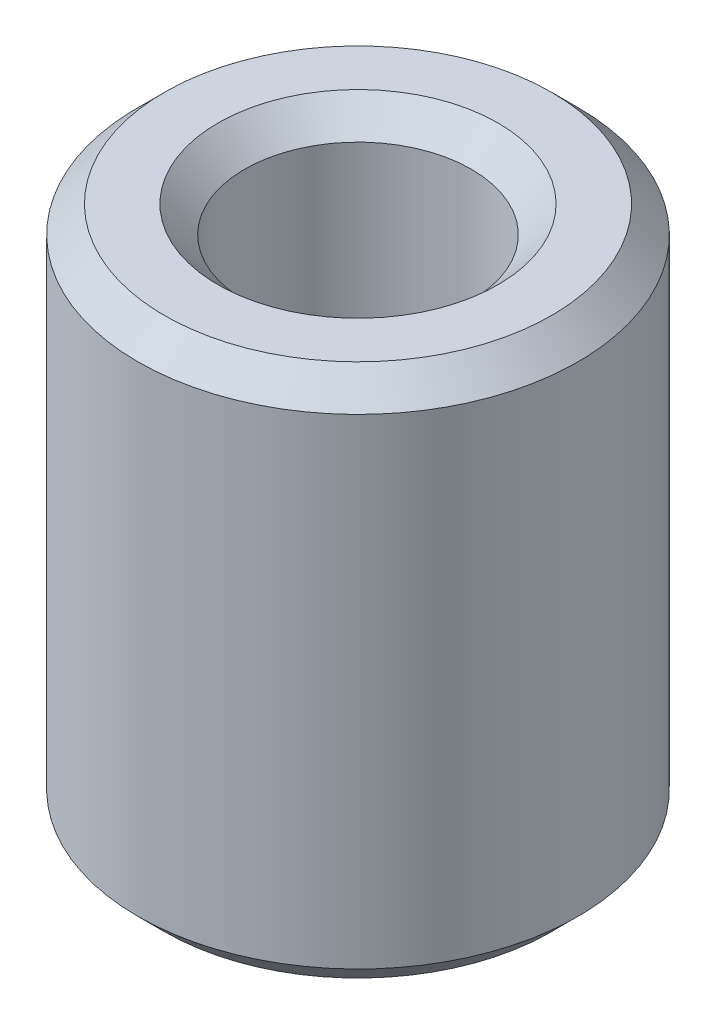
from build123d import *

# Parameters (mm, degrees)
CHAMFER1_SIZE = 1


with BuildPart() as part:
    # Sketch1 → Revolve1 (revolve)
    with BuildSketch(Plane(origin=(0, 0, 0), x_dir=(0, 0, -1), z_dir=(1, 0, 0)), mode=Mode.PRIVATE) as revolve1_sk:
        Polygon((-4.25, 20), (-4.25, 12), (-2.75, 8), (-2.75, 0), (-8.25, 0), (-8.25, 20), align=None)
    revolve(revolve1_sk.sketch.rotate(Axis((0, 0, 0), (0, 1, 0)), 180), axis=Axis((0, 0, 0), (0, 1, 0)))

    # Chamfer1
    chamfer1_edges = [part.edges().sort_by_distance(p)[0] for p in [
        (0, 20, 8.25),
        (0, 0, 8.25),
        (0, 0, 2.75),
        (0, 20, 4.25),
    ]]
    chamfer(chamfer1_edges, length=CHAMFER1_SIZE)


solid = part.part
